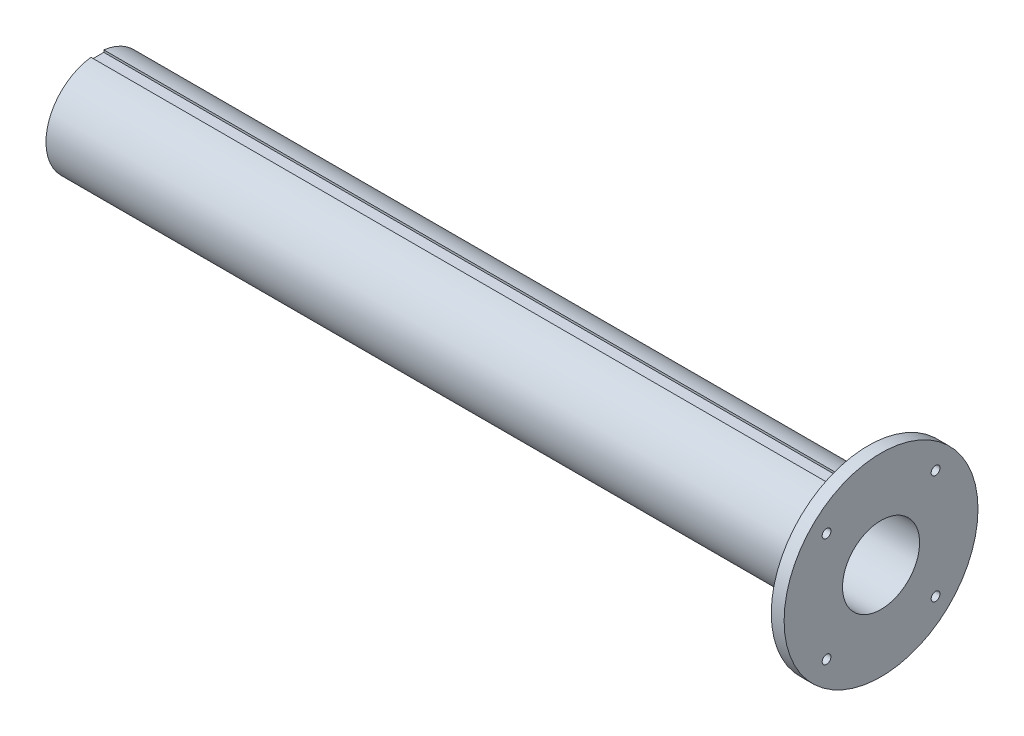
from build123d import *

# Parameters (mm, degrees)
SKETCH2_W             = 10
SKETCH2_H             = 4
EXTRUDE1_DEPTH        = 600
M8_TAPPED_HOLE1_D     = 6.8
M8_TAPPED_HOLE1_DEPTH = 19.75
M8_TAPPED_HOLE1_TIP   = 2.042926105


with BuildPart() as part:
    # Sketch1 → Revolve1 (revolve)
    with BuildSketch(Plane.XY, mode=Mode.PRIVATE) as revolve1_sk:
        Polygon((-108.27123445, 10), (-108.27123445, 0), (491.72876555, 0), (491.72876555, -35.462555066), (501.72876555, -35.462555066), (501.72876555, 10), align=None)
    revolve(revolve1_sk.sketch.rotate(Axis((-148.45814978, 40, 0), (1, 0, 0)), 270), axis=Axis((-148.45814978, 40, 0), (1, 0, 0)))

    # Sketch2 → Extrude1 (cut)
    with BuildSketch(Plane.ZY.offset(108.27123445)):
        with Locations((0, 80)):
            Rectangle(SKETCH2_W, SKETCH2_H)
    extrude(amount=-EXTRUDE1_DEPTH, mode=Mode.SUBTRACT)

    # M8 Tapped Hole1
    with Locations(Plane(origin=(501.72876555, 82.426406871, 42.426406871), x_dir=(0, 0, 1), z_dir=(1, 0, 0))):
        with Locations((0, 0), (-84.852813742, 0), (-84.852813742, 84.852813742), (0, 84.852813742)):
            Hole(M8_TAPPED_HOLE1_D / 2, depth=M8_TAPPED_HOLE1_DEPTH)
            with Locations((0, 0, -(M8_TAPPED_HOLE1_DEPTH + M8_TAPPED_HOLE1_TIP / 2))):  # 118° drill point
                Cone(0, M8_TAPPED_HOLE1_D / 2, M8_TAPPED_HOLE1_TIP, mode=Mode.SUBTRACT)


solid = part.part
